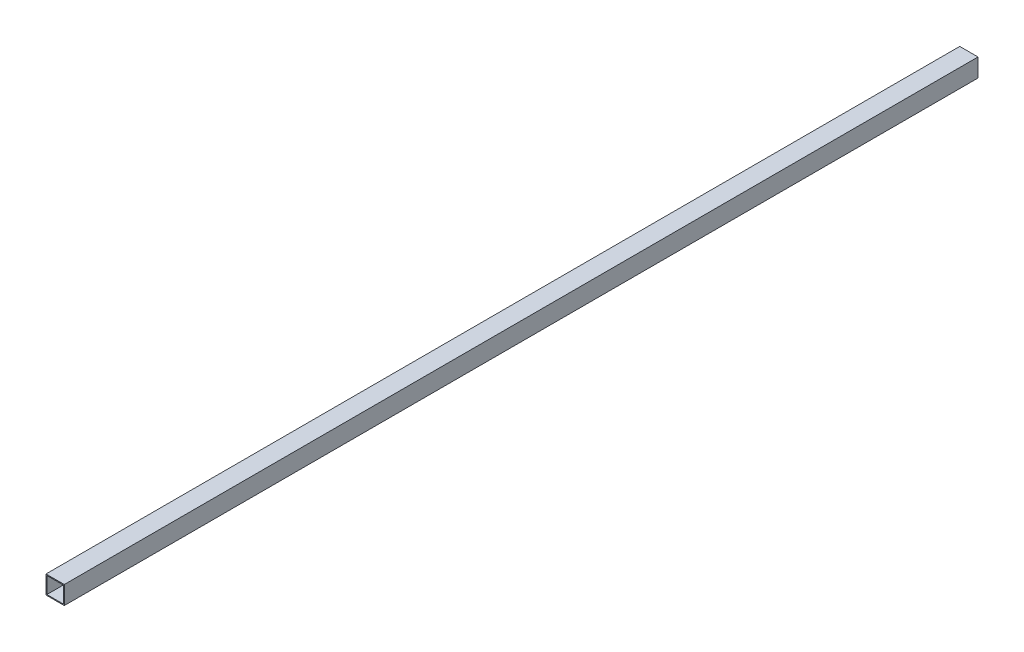
from build123d import *

# Parameters (mm, degrees)
SKETCH1_W           = 20
SKETCH1_H           = 20
SKETCH1_W_2         = 18
SKETCH1_H_2         = 18
BOSS_EXTRUDE1_DEPTH = 1000


with BuildPart() as part:
    # Sketch1 → Boss-Extrude1 (new body)
    with BuildSketch(Plane.XY):
        with Locations((10, -10)):
            Rectangle(SKETCH1_W, SKETCH1_H)
        with Locations((10, -10)):
            Rectangle(SKETCH1_W_2, SKETCH1_H_2, mode=Mode.SUBTRACT)
    extrude(amount=BOSS_EXTRUDE1_DEPTH)


solid = part.part
